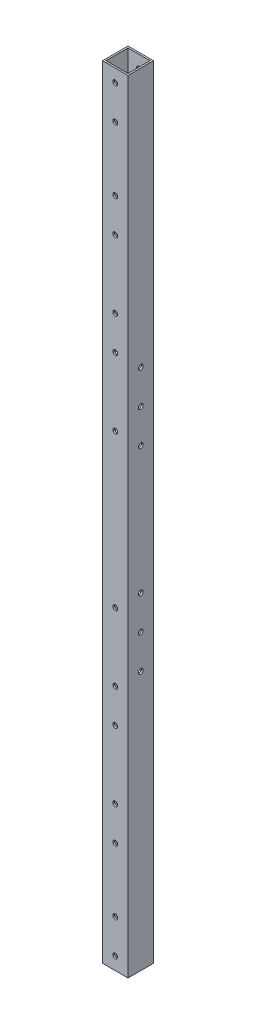
from build123d import *

# Parameters (mm, degrees)
SKETCH_1_W          = 15
SKETCH_1_H          = 15
SKETCH_1_W_2        = 13
SKETCH_1_H_2        = 13
EXTRUDE_1_DEPTH     = 460
SKETCH_2_R          = 1.45
CUT_EXTRUDE_1_DEPTH = 461.305605006
SKETCH_3_R          = 1.45
CUT_EXTRUDE_2_DEPTH = 461.305605006


with BuildPart() as part:
    # 草图1 → 拉伸-薄壁1 (new body)
    with BuildSketch(Plane(origin=(0, 0, 0), x_dir=(1, 0, 0), z_dir=(0, 1, 0))):
        Rectangle(SKETCH_1_W, SKETCH_1_H)
        Rectangle(SKETCH_1_W_2, SKETCH_1_H_2, mode=Mode.SUBTRACT)
    extrude(amount=EXTRUDE_1_DEPTH)

    # 草图2 → 切除-拉伸1 (cut, through all)
    with BuildSketch(Plane.XY.offset(7.5)):
        with Locations((0, 7.5)):
            Circle(SKETCH_2_R)
        with Locations((0, 27.5)):
            Circle(SKETCH_2_R)
        with Locations(Location((0, 432.5, 0), (0, 0, 180))):
            Circle(SKETCH_2_R)
        with Locations(Location((0, 452.5, 0), (0, 0, 180))):
            Circle(SKETCH_2_R)
        with Locations((0, 65)):
            Circle(SKETCH_2_R)
        with Locations((0, 85)):
            Circle(SKETCH_2_R)
        with Locations((0, 125)):
            Circle(SKETCH_2_R)
        with Locations((0, 145)):
            Circle(SKETCH_2_R)
        with Locations(Location((0, 315, 0), (0, 0, 180))):
            Circle(SKETCH_2_R)
        with Locations(Location((0, 335, 0), (0, 0, 180))):
            Circle(SKETCH_2_R)
        with Locations(Location((0, 375, 0), (0, 0, 180))):
            Circle(SKETCH_2_R)
        with Locations(Location((0, 395, 0), (0, 0, 180))):
            Circle(SKETCH_2_R)
        with Locations((0, 185)):
            Circle(SKETCH_2_R)
        with Locations(Location((0, 275, 0), (0, 0, 180))):
            Circle(SKETCH_2_R)
    extrude(amount=-CUT_EXTRUDE_1_DEPTH, mode=Mode.SUBTRACT)

    # 草图3 → 切除-拉伸2 (cut, through all)
    with BuildSketch(Plane(origin=(7.5, 0, 0), x_dir=(0, 0, -1), z_dir=(1, 0, 0))):
        with Locations((0, 152.5)):
            Circle(SKETCH_3_R)
        with Locations((0, 172.5)):
            Circle(SKETCH_3_R)
        with Locations((0, 287.5)):
            Circle(SKETCH_3_R)
        with Locations((0, 307.5)):
            Circle(SKETCH_3_R)
        with Locations((0, 192.5)):
            Circle(SKETCH_3_R)
        with Locations((0, 267.5)):
            Circle(SKETCH_3_R)
    extrude(amount=-CUT_EXTRUDE_2_DEPTH, mode=Mode.SUBTRACT)


solid = part.part
